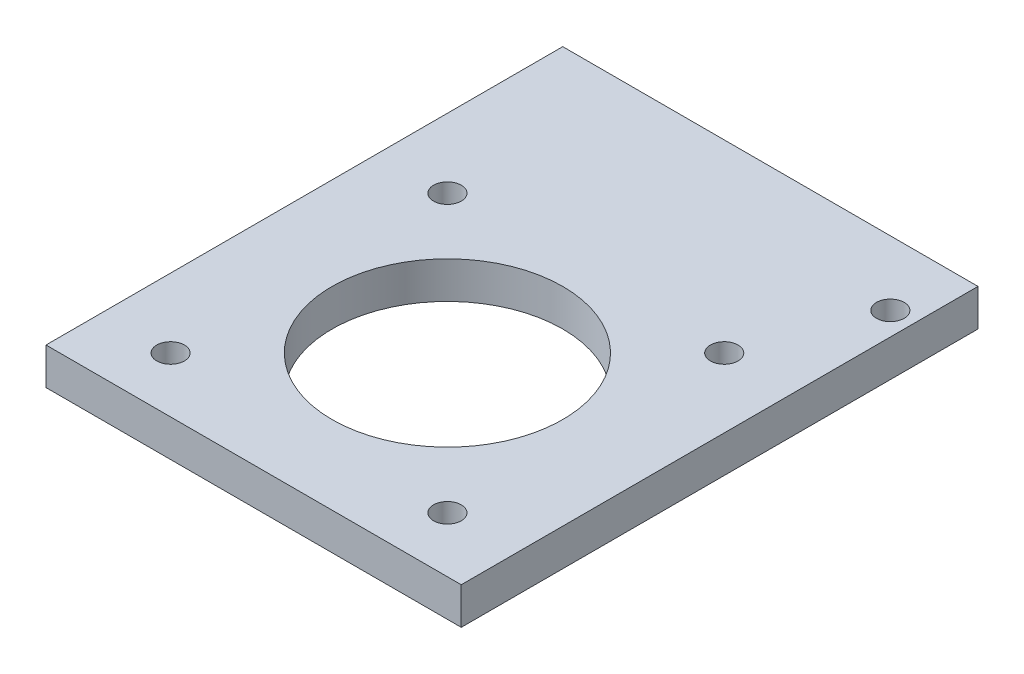
from build123d import *

# Parameters (mm, degrees)
ESBO_O1_W                = 45
ESBO_O1_H                = 56
RESSALTO_EXTRUS_O1_DEPTH = 4
ESBO_O4_R                = 1.5
ESBO_O4_R_2              = 12.5
CORTE_EXTRUS_O1_DEPTH    = 37.142080737


with BuildPart() as part:
    # Esboço1 → Ressalto-extrusão1 (new body)
    with BuildSketch(Plane(origin=(0, 0, 0), x_dir=(1, 0, 0), z_dir=(0, 1, 0))):
        Rectangle(ESBO_O1_W, ESBO_O1_H)
    extrude(amount=RESSALTO_EXTRUS_O1_DEPTH)

    # Esboço4 → Corte-extrusão1 (cut, through all)
    with BuildSketch(Plane(origin=(0, 4, 0), x_dir=(1, 0, 0), z_dir=(0, 1, 0))):
        with Locations(Location((-15, 8, 0), (0, 0, 270))):
            Circle(ESBO_O4_R)
        with Locations(Location((-15, -22, 0), (0, 0, 270))):
            Circle(ESBO_O4_R)
        with Locations(Location((15, -22, 0), (0, 0, 270))):
            Circle(ESBO_O4_R)
        with Locations(Location((15, 8, 0), (0, 0, 270))):
            Circle(ESBO_O4_R)
        with Locations(Location((20, 21, 0), (0, 0, 270))):
            Circle(ESBO_O4_R)
        with Locations(Location((0, -7, 0), (0, 0, 270))):
            Circle(ESBO_O4_R_2)
    extrude(amount=-CORTE_EXTRUS_O1_DEPTH, mode=Mode.SUBTRACT)


solid = part.part
